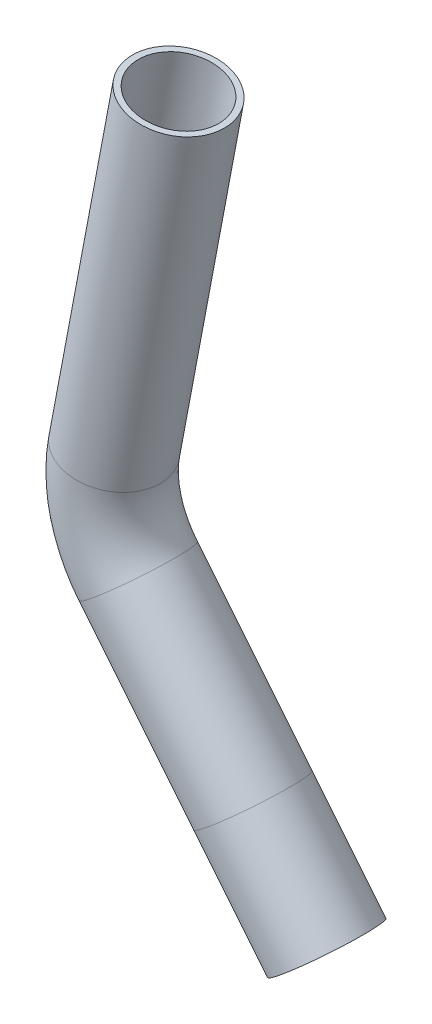
from build123d import *

# Parameters (mm, degrees)
SKETCH_2_R   = 4
SKETCH_2_R_2 = 3.5


with BuildPart() as part:
    # По траектории1: sweep along a path in Эскиз1
    with BuildLine(Plane.XY) as sweep_1_path:
        Line((-12.67059026, 57.046486939), (-18.171515217, 27.990319213))
        ThreePointArc((-18.171515217, 27.990319213), (-18.041069279, 23.679327915), (-16.107188295, 19.824231748))
        Line((-16.107188295, 19.824231748), (-6.305926251, 7.761140001))
        Line((-6.305926251, 7.761140001), (0, 0))
    # Эскиз2 → По траектории1 (sweep)
    with BuildSketch(Plane(origin=(0, 0, 0), x_dir=(-0.7761140001162656, -0.6305926250944656, 0), z_dir=(0.6305926250944656, -0.7761140001162656, 0))):
        Circle(SKETCH_2_R)
        Circle(SKETCH_2_R_2, mode=Mode.SUBTRACT)
    sweep(path=sweep_1_path.line)


solid = part.part
